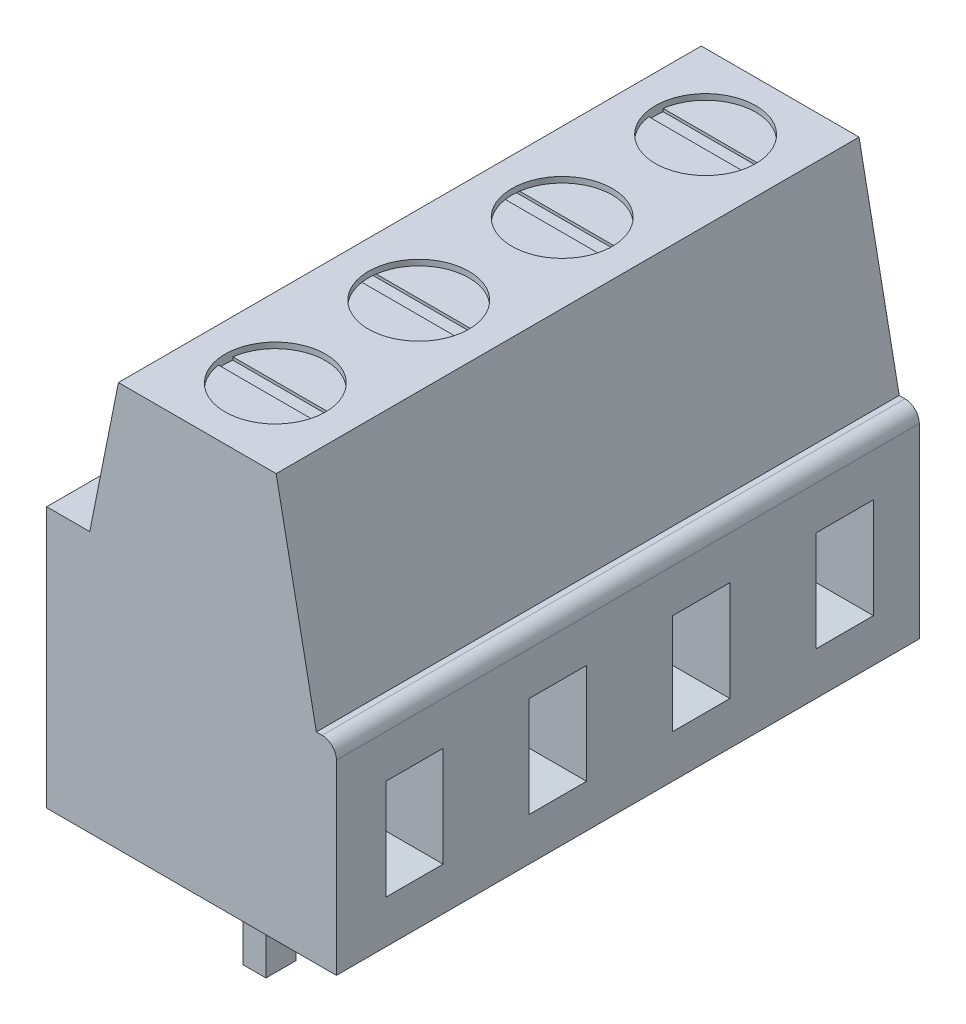
from build123d import *

# Parameters (mm, degrees)
BOSS_EXTRUDE1_DEPTH          = 10.16
FILLET1_R                    = 0.5
CUT_EXTRUDE1_DEPTH           = 21.100885553
CUT_EXTRUDE1_DEPTH_BACK      = 0.2
SKETCH2_R                    = 1.75
SKETCH3_W                    = 0.8
SKETCH3_H                    = 1.05200998
BOSS_EXTRUDE2_DEPTH          = 3.5
SKETCH4_W                    = 2
SKETCH4_H                    = 3.5
CUT_EXTRUDE2_DEPTH           = 2
CUT_EXTRUDE2_DRAFT           = -10
CUT_EXTRUDE2_PROFILE_2_DEPTH = 2
CUT_EXTRUDE2_PROFILE_2_DRAFT = -10
CUT_EXTRUDE2_PROFILE_3_DEPTH = 2
CUT_EXTRUDE2_PROFILE_3_DRAFT = -10
CUT_EXTRUDE2_PROFILE_4_DEPTH = 2
CUT_EXTRUDE2_PROFILE_4_DRAFT = -10
SKETCH5_W                    = 4.000724796
SKETCH5_H                    = 0.5
CUT_EXTRUDE3_DEPTH           = 0.1


with BuildPart() as part:
    # Sketch1 → Boss-Extrude1 (new, symmetric)
    with BuildSketch(Plane.XY):
        Polygon((0, 9.1), (1.5, 9.1), (2.5, 14.1), (8, 14.1), (9.4, 7), (10.1, 7), (10.1, 0), (0, 0), align=None)
    extrude(amount=BOSS_EXTRUDE1_DEPTH, both=True)

    # Fillet1
    fillet1_edges = [part.edges().sort_by_distance(p)[0] for p in [
        (10.1, 7, 0),
    ]]
    fillet(fillet1_edges, radius=FILLET1_R)

    # Sketch2 → Cut-Extrude1 (cut, two sides: drawn at the far end of the back side and taken through both)
    with BuildSketch(Plane(origin=(0, 14.1, 0), x_dir=(1, 0, 0), z_dir=(0, 1, 0)).offset(-CUT_EXTRUDE1_DEPTH_BACK)):
        with Locations(Location((5.25, 7.56, 0), (0, 0, 90))):
            Circle(SKETCH2_R)
        with Locations(Location((5.25, 2.56, 0), (0, 0, 90))):
            Circle(SKETCH2_R)
        with Locations(Location((5.25, -2.44, 0), (0, 0, 90))):
            Circle(SKETCH2_R)
        with Locations(Location((5.25, -7.44, 0), (0, 0, 90))):
            Circle(SKETCH2_R)
    extrude(amount=CUT_EXTRUDE1_DEPTH + CUT_EXTRUDE1_DEPTH_BACK, mode=Mode.SUBTRACT)

    # Sketch3 → Boss-Extrude2 (add)
    with BuildSketch(Plane.XZ):
        with Locations((5.05, 7.44)):
            Rectangle(SKETCH3_W, SKETCH3_H)
        with Locations((5.05, 2.44)):
            Rectangle(SKETCH3_W, SKETCH3_H)
        with Locations((5.05, -2.56)):
            Rectangle(SKETCH3_W, SKETCH3_H)
        with Locations((5.05, -7.56)):
            Rectangle(SKETCH3_W, SKETCH3_H)
    extrude(amount=BOSS_EXTRUDE2_DEPTH)


with BuildPart() as cut_extrude2_tool:
    # Sketch4 → Cut-Extrude2 (with draft: the straight prism first)
    with BuildSketch(Plane(origin=(10.1, 0, 0), x_dir=(0, 0, -1), z_dir=(1, 0, 0))):
        with Locations((-2.44, 3.25)):
            Rectangle(SKETCH4_W, SKETCH4_H)
    extrude(amount=-CUT_EXTRUDE2_DEPTH)
    # Cut-Extrude2: the draft: its side faces are tilted about the plane it starts from
    cut_extrude2_sides = [cut_extrude2_tool.faces().sort_by_distance(p)[0] for p in [
        (9.1, 3.25, 3.44),
        (9.1, 1.5, 2.44),
        (9.1, 3.25, 1.44),
        (9.1, 5, 2.44),
    ]]
    draft(cut_extrude2_sides, Plane(origin=(10.1, 0, 0), x_dir=(0, 0, -1), z_dir=(1, 0, 0)), CUT_EXTRUDE2_DRAFT)


with BuildPart() as part_1:
    add(part.part)

    # Cut-Extrude2: cut by cut_extrude2_tool
    add(cut_extrude2_tool.part, mode=Mode.SUBTRACT)


with BuildPart() as cut_extrude2_profile_2_tool:
    # Sketch4 → Cut-Extrude2 profile 2 (with draft: the straight prism first)
    with BuildSketch(Plane(origin=(10.1, 0, 0), x_dir=(0, 0, -1), z_dir=(1, 0, 0))):
        with Locations((-7.44, 3.25)):
            Rectangle(SKETCH4_W, SKETCH4_H)
    extrude(amount=-CUT_EXTRUDE2_PROFILE_2_DEPTH)
    # Cut-Extrude2 profile 2: the draft: its side faces are tilted about the plane it starts from
    cut_extrude2_profile_2_sides = [cut_extrude2_profile_2_tool.faces().sort_by_distance(p)[0] for p in [
        (9.1, 3.25, 8.44),
        (9.1, 1.5, 7.44),
        (9.1, 3.25, 6.44),
        (9.1, 5, 7.44),
    ]]
    draft(cut_extrude2_profile_2_sides, Plane(origin=(10.1, 0, 0), x_dir=(0, 0, -1), z_dir=(1, 0, 0)), CUT_EXTRUDE2_PROFILE_2_DRAFT)


with BuildPart() as part_2:
    add(part_1.part)

    # Cut-Extrude2 profile 2: cut by cut_extrude2_profile_2_tool
    add(cut_extrude2_profile_2_tool.part, mode=Mode.SUBTRACT)


with BuildPart() as cut_extrude2_profile_3_tool:
    # Sketch4 → Cut-Extrude2 profile 3 (with draft: the straight prism first)
    with BuildSketch(Plane(origin=(10.1, 0, 0), x_dir=(0, 0, -1), z_dir=(1, 0, 0))):
        with Locations((2.56, 3.25)):
            Rectangle(SKETCH4_W, SKETCH4_H)
    extrude(amount=-CUT_EXTRUDE2_PROFILE_3_DEPTH)
    # Cut-Extrude2 profile 3: the draft: its side faces are tilted about the plane it starts from
    cut_extrude2_profile_3_sides = [cut_extrude2_profile_3_tool.faces().sort_by_distance(p)[0] for p in [
        (9.1, 3.25, -1.56),
        (9.1, 1.5, -2.56),
        (9.1, 3.25, -3.56),
        (9.1, 5, -2.56),
    ]]
    draft(cut_extrude2_profile_3_sides, Plane(origin=(10.1, 0, 0), x_dir=(0, 0, -1), z_dir=(1, 0, 0)), CUT_EXTRUDE2_PROFILE_3_DRAFT)


with BuildPart() as part_3:
    add(part_2.part)

    # Cut-Extrude2 profile 3: cut by cut_extrude2_profile_3_tool
    add(cut_extrude2_profile_3_tool.part, mode=Mode.SUBTRACT)


with BuildPart() as cut_extrude2_profile_4_tool:
    # Sketch4 → Cut-Extrude2 profile 4 (with draft: the straight prism first)
    with BuildSketch(Plane(origin=(10.1, 0, 0), x_dir=(0, 0, -1), z_dir=(1, 0, 0))):
        with Locations((7.56, 3.25)):
            Rectangle(SKETCH4_W, SKETCH4_H)
    extrude(amount=-CUT_EXTRUDE2_PROFILE_4_DEPTH)
    # Cut-Extrude2 profile 4: the draft: its side faces are tilted about the plane it starts from
    cut_extrude2_profile_4_sides = [cut_extrude2_profile_4_tool.faces().sort_by_distance(p)[0] for p in [
        (9.1, 3.25, -6.56),
        (9.1, 1.5, -7.56),
        (9.1, 3.25, -8.56),
        (9.1, 5, -7.56),
    ]]
    draft(cut_extrude2_profile_4_sides, Plane(origin=(10.1, 0, 0), x_dir=(0, 0, -1), z_dir=(1, 0, 0)), CUT_EXTRUDE2_PROFILE_4_DRAFT)


with BuildPart() as part_4:
    add(part_3.part)

    # Cut-Extrude2 profile 4: cut by cut_extrude2_profile_4_tool
    add(cut_extrude2_profile_4_tool.part, mode=Mode.SUBTRACT)

    # Sketch5 → Cut-Extrude3 (cut)
    with BuildSketch(Plane(origin=(0, 13.9, 0), x_dir=(1, 0, 0), z_dir=(0, 1, 0))):
        with BuildLine():
            Line((6.982050808, 7.81), (3.517949192, 7.81))
            ThreePointArc((3.517949192, 7.81), (3.5, 7.56), (3.517949192, 7.31))
            Line((3.517949192, 7.31), (6.982050808, 7.31))
            ThreePointArc((6.982050808, 7.31), (6.995506934, 7.434678241), (7, 7.56))
            ThreePointArc((7, 7.56), (6.995506934, 7.685321759), (6.982050808, 7.81))
        make_face()
        with BuildLine():
            Line((6.982050808, -7.19), (3.517949192, -7.19))
            ThreePointArc((3.517949192, -7.19), (3.5, -7.44), (3.517949192, -7.69))
            Line((3.517949192, -7.69), (6.982050808, -7.69))
            ThreePointArc((6.982050808, -7.69), (6.995506934, -7.565321759), (7, -7.44))
            ThreePointArc((7, -7.44), (6.995506934, -7.314678241), (6.982050808, -7.19))
        make_face()
        with Locations((5.343098393, 2.56)):
            Rectangle(SKETCH5_W, SKETCH5_H)
        with Locations((5.343098393, -2.44)):
            Rectangle(SKETCH5_W, SKETCH5_H)
    extrude(amount=-CUT_EXTRUDE3_DEPTH, mode=Mode.SUBTRACT)


solid = part_4.part
